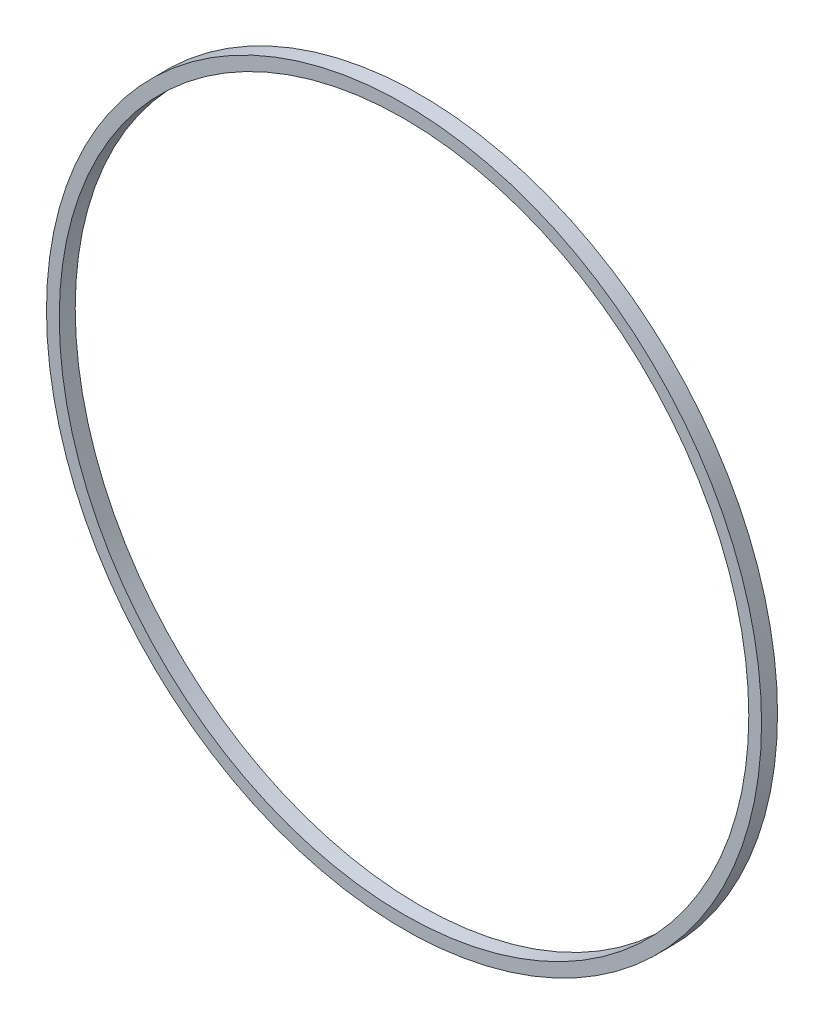
from build123d import *

# Parameters (mm, degrees)
SKETCH1_R           = 56
BOSS_EXTRUDE1_DEPTH = 2.5
SKETCH2_R           = 54
CUT_EXTRUDE1_DEPTH  = 2.5


with BuildPart() as part:
    # Sketch1 → Boss-Extrude1 (new body)
    with BuildSketch(Plane.XY):
        Circle(SKETCH1_R)
    extrude(amount=BOSS_EXTRUDE1_DEPTH)

    # Sketch2 → Cut-Extrude1 (cut)
    with BuildSketch(Plane.XY.offset(2.5)):
        Circle(SKETCH2_R)
    extrude(amount=-CUT_EXTRUDE1_DEPTH, mode=Mode.SUBTRACT)


solid = part.part
